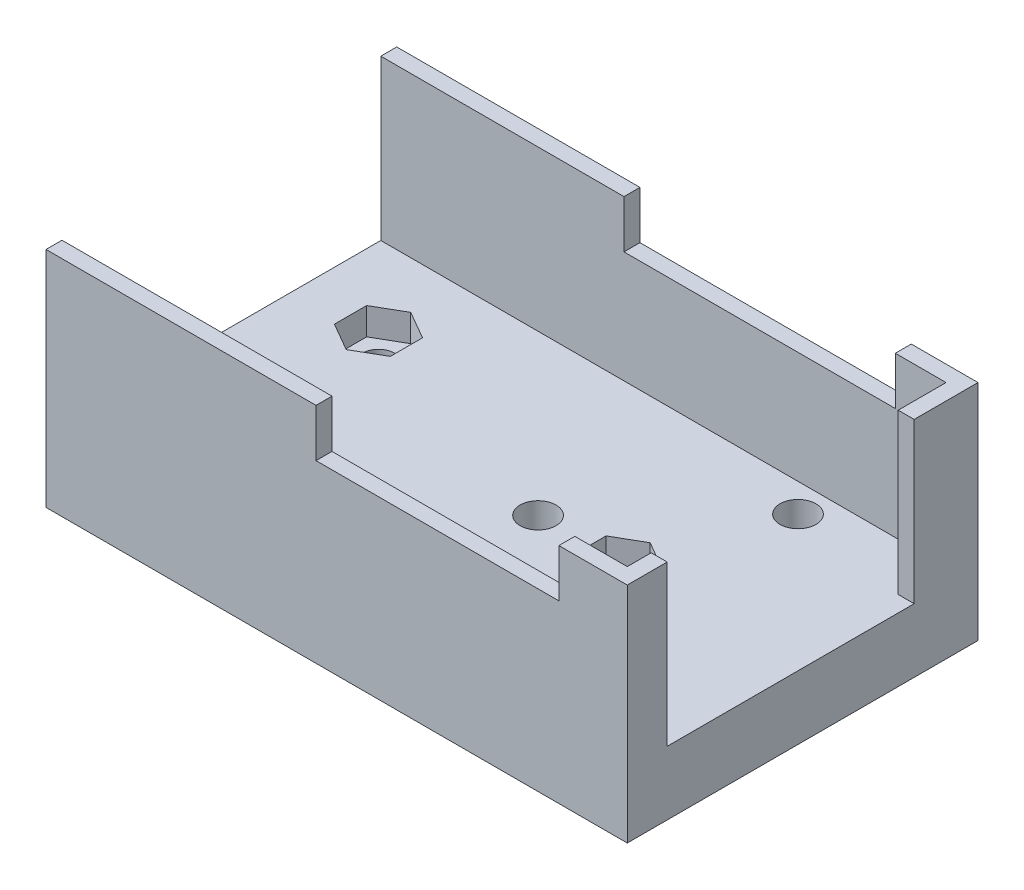
from build123d import *

# Parameters (mm, degrees)
SKETCH4_W                      = 72.837083297
SKETCH4_H                      = 43.95
BOSS_EXTRUDE1_DEPTH            = 8
BOSS_EXTRUDE2_DEPTH            = 14
SKETCH6_W                      = 30.477083297
SKETCH6_H                      = 2
SKETCH6_W_2                    = 33.837083297
BOSS_EXTRUDE3_DEPTH            = 6
CBORE_FOR_M4_SHCS1_D           = 4.5
CBORE_FOR_M4_SHCS1_CBORE_D     = 8
CBORE_FOR_M4_SHCS1_CBORE_DEPTH = 4
F_4_0MM_DOWEL_HOLE1_D          = 4
CUT_EXTRUDE1_DEPTH             = 3.4


with BuildPart() as part:
    # Sketch4 → Boss-Extrude1 (new body)
    with BuildSketch(Plane(origin=(0, 0, 0), x_dir=(1, 0, 0), z_dir=(0, 1, 0))):
        with Locations((-0.418541648, 0)):
            Rectangle(SKETCH4_W, SKETCH4_H)
    extrude(amount=BOSS_EXTRUDE1_DEPTH)

    # Sketch5 → Boss-Extrude2 (add)
    with BuildSketch(Plane(origin=(0, 8, 0), x_dir=(1, 0, 0), z_dir=(0, 1, 0))):
        Polygon((36, 13.975), (34, 13.975), (34, 19.975), (-36.837083297, 19.975), (-36.837083297, 21.975), (36, 21.975), align=None)
        Polygon((-36.837083297, -21.975), (36, -21.975), (36, -16.975), (34, -16.975), (34, -19.975), (-36.837083297, -19.975), align=None)
    extrude(amount=BOSS_EXTRUDE2_DEPTH)

    # Sketch6 → Boss-Extrude3 (add)
    with BuildSketch(Plane(origin=(0, 22, 0), x_dir=(1, 0, 0), z_dir=(0, 1, 0))):
        with Locations((-21.598541648, 20.975)):
            Rectangle(SKETCH6_W, SKETCH6_H)
        Polygon((36, 21.975), (27.64, 21.975), (27.64, 19.975), (34, 19.975), (34, 13.975), (36, 13.975), align=None)
        Polygon((36, -21.975), (27.43, -21.975), (27.43, -19.975), (34, -19.975), (34, -16.975), (36, -16.975), align=None)
        with Locations((-19.918541648, -20.975)):
            Rectangle(SKETCH6_W_2, SKETCH6_H)
    extrude(amount=BOSS_EXTRUDE3_DEPTH)

    # CBORE for M4 SHCS1 (through all)
    with Locations(Plane(origin=(0, 0, 0), x_dir=(-1, 0, 0), z_dir=(0, -1, 0))):
        with Locations((-2.85, 0), (-19, 16.42), (-19, -16.42)):
            CounterBoreHole(CBORE_FOR_M4_SHCS1_D / 2, CBORE_FOR_M4_SHCS1_CBORE_D / 2, CBORE_FOR_M4_SHCS1_CBORE_DEPTH)

    # Ø4.0mm Dowel Hole1 (through all)
    with Locations(Plane(origin=(0, 0, 0), x_dir=(-1, 0, 0), z_dir=(0, -1, 0))):
        with Locations((-12.84040165, 0.00815259), (27.15959835, 10.00815259), (27.15959835, -9.99184741)):
            Hole(F_4_0MM_DOWEL_HOLE1_D / 2)

    # Sketch12 → Cut-Extrude1 (cut)
    with BuildSketch(Plane(origin=(0, 8, 0), x_dir=(1, 0, 0), z_dir=(0, 1, 0))):
        Polygon((12.84040165, 4.049604475), (9.34040165, 2.028878533), (9.34040165, -2.012573352), (12.84040165, -4.033299294), (16.34040165, -2.012573352), (16.34040165, 2.028878533), align=None)
        Polygon((-27.15959835, 14.049604475), (-30.65959835, 12.028878533), (-30.65959835, 7.987426648), (-27.15959835, 5.966700706), (-23.65959835, 7.987426648), (-23.65959835, 12.028878533), align=None)
        Polygon((-27.15959835, -5.950395525), (-30.65959835, -7.971121467), (-30.65959835, -12.012573352), (-27.15959835, -14.033299294), (-23.65959835, -12.012573352), (-23.65959835, -7.971121467), align=None)
    extrude(amount=-CUT_EXTRUDE1_DEPTH, mode=Mode.SUBTRACT)


solid = part.part
